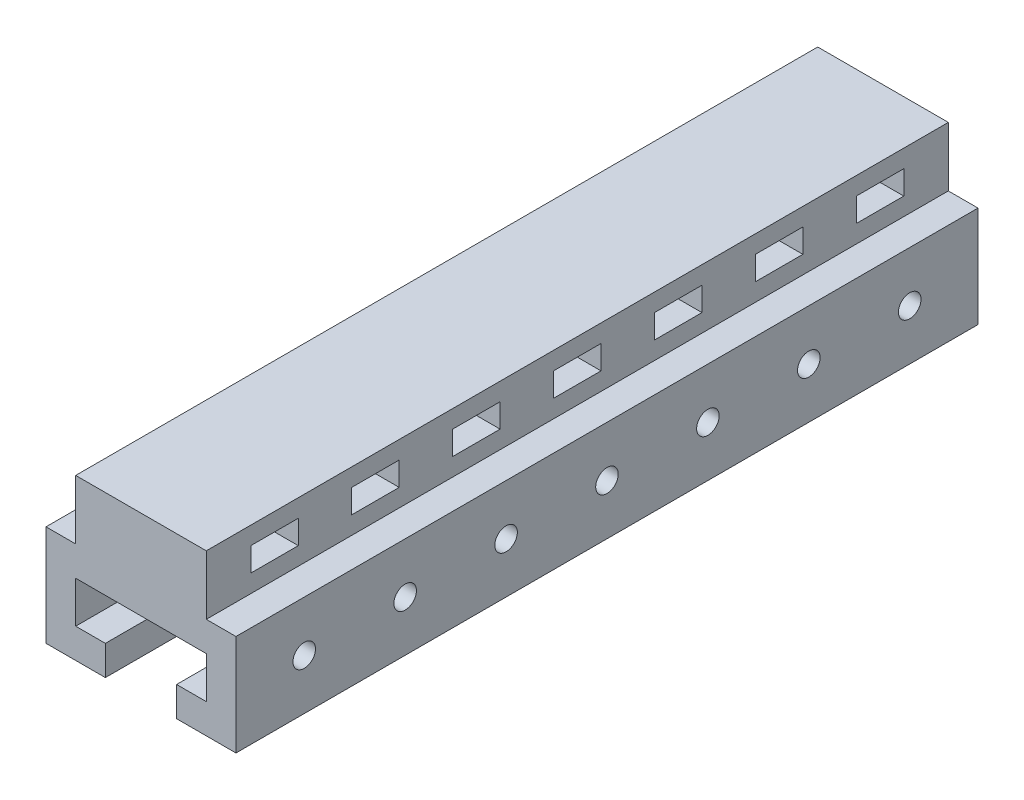
from build123d import *

# Parameters (mm, degrees)
BOSS_EXTRUDE1_DEPTH = 125
SKETCH2_R           = 1.9
CUT_EXTRUDE1_DEPTH  = 131.893086143
SKETCH3_W           = 8
SKETCH3_H           = 4
CUT_EXTRUDE2_DEPTH  = 130.761319352


with BuildPart() as part:
    # Sketch1 → Boss-Extrude1 (new body)
    with BuildSketch(Plane.XY):
        Polygon((11, 5), (-11, 5), (-11, -5), (-16, -5), (-16, -22), (-6, -22), (-6, -17), (-11, -17), (-11, -10), (11, -10), (11, -17), (6, -17), (6, -22), (16, -22), (16, -5), (11, -5), align=None)
    extrude(amount=-BOSS_EXTRUDE1_DEPTH)

    # Sketch2 → Cut-Extrude1 (cut, through all)
    with BuildSketch(Plane(origin=(16, 0, 0), x_dir=(0, 0, -1), z_dir=(1, 0, 0))):
        with Locations((62.5, -13.5)):
            Circle(SKETCH2_R)
        with Locations((79.5, -13.5)):
            Circle(SKETCH2_R)
        with Locations((96.5, -13.5)):
            Circle(SKETCH2_R)
        with Locations((45.5, -13.5)):
            Circle(SKETCH2_R)
        with Locations((28.5, -13.5)):
            Circle(SKETCH2_R)
        with Locations((113.5, -13.5)):
            Circle(SKETCH2_R)
        with Locations((11.5, -13.5)):
            Circle(SKETCH2_R)
    extrude(amount=-CUT_EXTRUDE1_DEPTH, mode=Mode.SUBTRACT)

    # Sketch3 → Cut-Extrude2 (cut, through all)
    with BuildSketch(Plane(origin=(11, 0, 0), x_dir=(0, 0, -1), z_dir=(1, 0, 0))):
        with Locations((79.5, 0)):
            Rectangle(SKETCH3_W, SKETCH3_H)
        with Locations((62.5, 0)):
            Rectangle(SKETCH3_W, SKETCH3_H)
        with Locations((96.5, 0)):
            Rectangle(SKETCH3_W, SKETCH3_H)
        with Locations((45.5, 0)):
            Rectangle(SKETCH3_W, SKETCH3_H)
        with Locations((28.5, 0)):
            Rectangle(SKETCH3_W, SKETCH3_H)
        with Locations((113.5, 0)):
            Rectangle(SKETCH3_W, SKETCH3_H)
        with Locations((11.5, 0)):
            Rectangle(SKETCH3_W, SKETCH3_H)
    extrude(amount=-CUT_EXTRUDE2_DEPTH, mode=Mode.SUBTRACT)


solid = part.part
